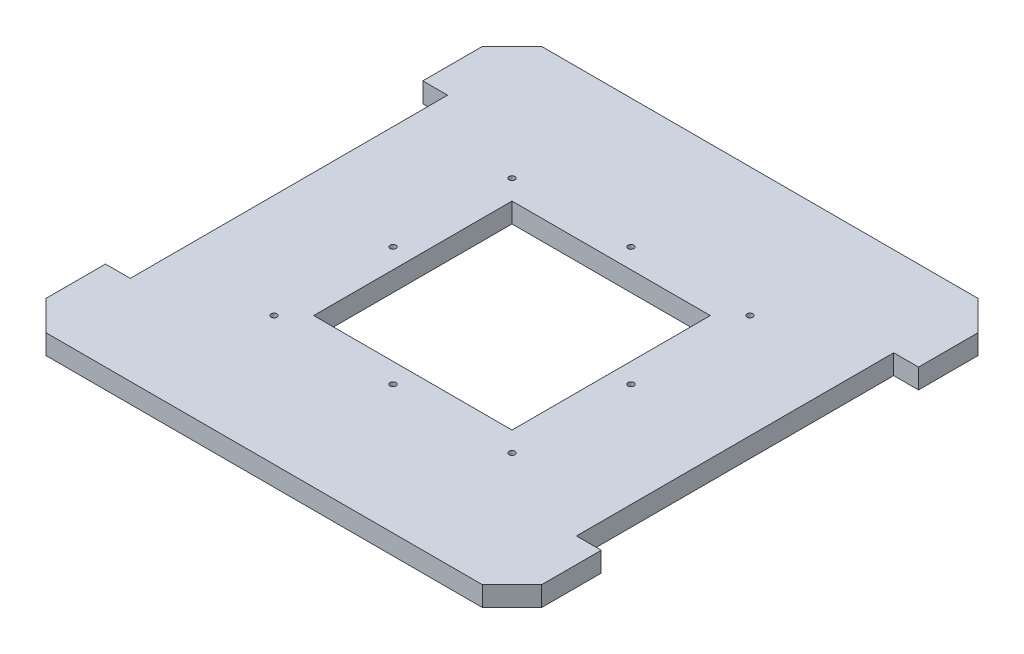
from build123d import *

# Parameters (mm, degrees)
CROQUIS2_R              = 0.75
CROQUIS2_W              = 50
CROQUIS2_H              = 50
SALIENTE_EXTRUIR1_DEPTH = 5
CROQUIS3_W              = 6.25
CROQUIS3_H              = 80
CORTAR_EXTRUIR1_DEPTH   = 5


with BuildPart() as part:
    # Croquis2 → Saliente-Extruir1 (new body)
    with BuildSketch(Plane(origin=(0, 0, 0), x_dir=(1, 0, 0), z_dir=(0, 1, 0))):
        Polygon((-62.5, 0), (-62.5, 55), (-55, 62.5), (55, 62.5), (62.5, 55), (62.5, -55), (55, -62.5), (-55, -62.5), (-62.5, -55), align=None)
        with Locations(Location((30, 30, 0), (0, 0, 270))):
            Circle(CROQUIS2_R, mode=Mode.SUBTRACT)
        with Locations(Location((30, 0, 0), (0, 0, 270))):
            Circle(CROQUIS2_R, mode=Mode.SUBTRACT)
        with Locations(Location((30, -30, 0), (0, 0, 270))):
            Circle(CROQUIS2_R, mode=Mode.SUBTRACT)
        with Locations(Location((-30, -30, 0), (0, 0, 270))):
            Circle(CROQUIS2_R, mode=Mode.SUBTRACT)
        with Locations(Location((0, -30, 0), (0, 0, 270))):
            Circle(CROQUIS2_R, mode=Mode.SUBTRACT)
        with Locations(Location((-30, 0, 0), (0, 0, 270))):
            Circle(CROQUIS2_R, mode=Mode.SUBTRACT)
        with Locations(Location((-30, 30, 0), (0, 0, 270))):
            Circle(CROQUIS2_R, mode=Mode.SUBTRACT)
        with Locations(Location((0, 30, 0), (0, 0, 270))):
            Circle(CROQUIS2_R, mode=Mode.SUBTRACT)
        Rectangle(CROQUIS2_W, CROQUIS2_H, mode=Mode.SUBTRACT)
    extrude(amount=SALIENTE_EXTRUIR1_DEPTH)

    # Croquis3 → Cortar-Extruir1 (cut)
    with BuildSketch(Plane(origin=(0, 5, 0), x_dir=(1, 0, 0), z_dir=(0, 1, 0))):
        with Locations((59.375, 0)):
            Rectangle(CROQUIS3_W, CROQUIS3_H)
        with Locations((-59.375, 0)):
            Rectangle(CROQUIS3_W, CROQUIS3_H)
    extrude(amount=-CORTAR_EXTRUIR1_DEPTH, mode=Mode.SUBTRACT)


solid = part.part
